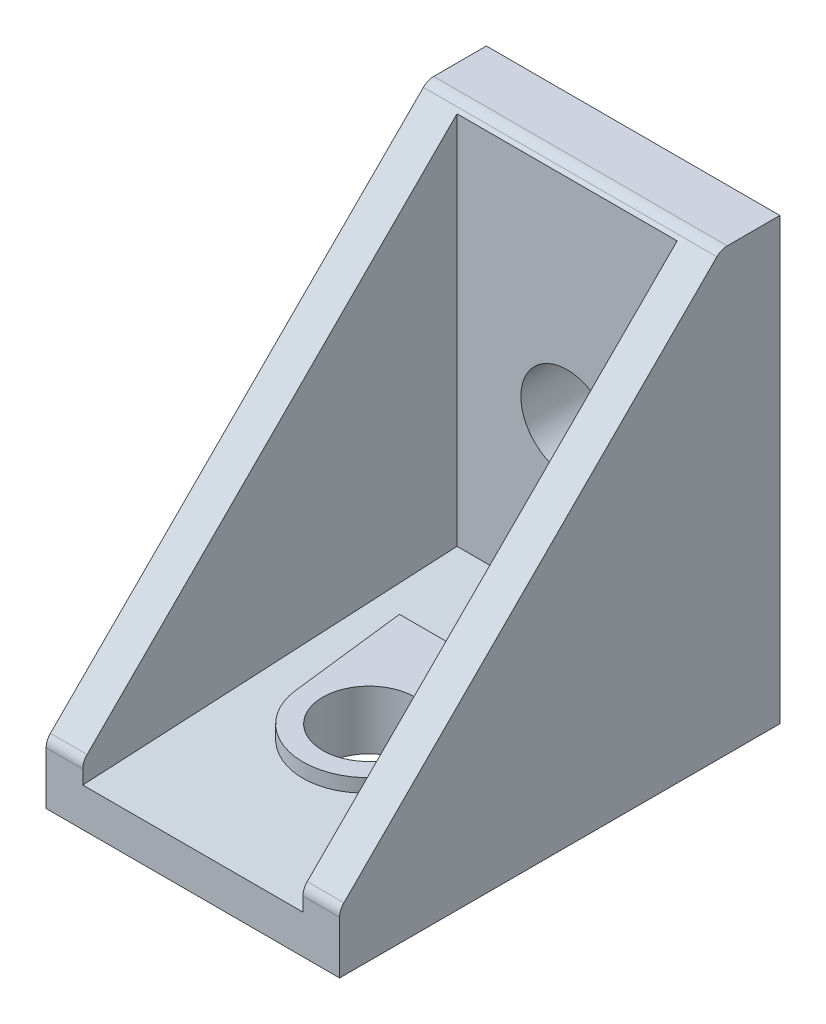
from build123d import *
from build123d.topology import SkipClean

# Parameters (mm, degrees)
BOSS_EXTRUDE1_DEPTH      = 10
BOSS_EXTRUDE1_DEPTH_BACK = 10
CUT_EXTRUDE1_DEPTH       = 7.5
CUT_EXTRUDE1_DEPTH_BACK  = 7.5
BOSS_EXTRUDE2_DEPTH      = 2
SKETCH4_R                = 3.15
CUT_EXTRUDE2_DEPTH       = 5
SKETCH5_R                = 3.15
CUT_EXTRUDE3_DEPTH       = 4
SKETCH6_W                = 20
SKETCH6_H                = 30
BOSS_EXTRUDE3_DEPTH      = 1
SKETCH7_W                = 20
SKETCH7_H                = 30
CUT_EXTRUDE4_DEPTH       = 1
SKETCH8_W                = 20
SKETCH8_H                = 30
BOSS_EXTRUDE4_DEPTH      = 1
CUT_EXTRUDE5_START       = -1
SKETCH9_W                = 20
SKETCH9_H                = 30
CUT_EXTRUDE5_DEPTH       = 1


with BuildPart() as part:
    # Sketch1 → Boss-Extrude1 (new, two sides: drawn at the far end of the back side and taken through both)
    with BuildSketch(Plane(origin=(0, 0, 0), x_dir=(0, 0, -1), z_dir=(1, 0, 0)).offset(-BOSS_EXTRUDE1_DEPTH_BACK)):
        with BuildLine():
            Line((-30, 0), (0, 0))
            Line((0, 0), (0, 30))
            Line((0, 30), (-3.585786438, 30))
            ThreePointArc((-3.585786438, 30), (-3.96846987, 29.923879533), (-4.292893219, 29.707106781))
            Line((-4.292893219, 29.707106781), (-29.707106781, 4.292893219))
            ThreePointArc((-29.707106781, 4.292893219), (-29.923879533, 3.96846987), (-30, 3.585786438))
            Line((-30, 3.585786438), (-30, 0))
        make_face()
    extrude(amount=BOSS_EXTRUDE1_DEPTH + BOSS_EXTRUDE1_DEPTH_BACK)

    # Sketch2 → Cut-Extrude1 (cut, two sides: drawn at the far end of the back side and taken through both)
    with BuildSketch(Plane(origin=(0, 0, 0), x_dir=(0, 0, -1), z_dir=(1, 0, 0)).offset(-CUT_EXTRUDE1_DEPTH_BACK)):
        Polygon((-34, 2.427766622), (-4.5, 3.97379611), (-4.5, 34), (-34, 34), align=None)
    extrude(amount=CUT_EXTRUDE1_DEPTH + CUT_EXTRUDE1_DEPTH_BACK, mode=Mode.SUBTRACT)

    # Sketch3 → Boss-Extrude2 (add)
    with BuildSketch(Plane(origin=(0, 4, 0), x_dir=(1, 0, 0), z_dir=(0, 1, 0))):
        with BuildLine():
            Line((-5.420884207, -10.5), (-4.4686916, -18.529901296))
            ThreePointArc((-4.4686916, -18.529901296), (0, -22.5), (4.4686916, -18.529901296))
            Line((4.4686916, -18.529901296), (5.420884207, -10.5))
            Line((5.420884207, -10.5), (-5.420884207, -10.5))
        make_face()
    extrude(amount=-BOSS_EXTRUDE2_DEPTH)

    # Sketch4 → Cut-Extrude2 (cut)
    with BuildSketch(Plane.XY):
        with Locations((0, 15)):
            Circle(SKETCH4_R)
    extrude(amount=CUT_EXTRUDE2_DEPTH, mode=Mode.SUBTRACT)

    # Sketch5 → Cut-Extrude3 (cut)
    with BuildSketch(Plane(origin=(0, 0, 0), x_dir=(1, 0, 0), z_dir=(0, 1, 0))):
        with Locations(Location((0, -18, 0), (0, 0, 270))):
            Circle(SKETCH5_R)
    extrude(amount=CUT_EXTRUDE3_DEPTH, mode=Mode.SUBTRACT)

    # Sketch6 → Boss-Extrude3 (add)
    with BuildSketch(Plane(origin=(0, 0, 0), x_dir=(1, 0, 0), z_dir=(0, 1, 0))):
        with Locations((0, -15)):
            Rectangle(SKETCH6_W, SKETCH6_H)
    extrude(amount=-BOSS_EXTRUDE3_DEPTH)

    # Sketch7 → Cut-Extrude4 (cut)
    with BuildSketch(Plane(origin=(0, 0, 0), x_dir=(1, 0, 0), z_dir=(0, 1, 0))):
        with Locations((0, -15)):
            Rectangle(SKETCH7_W, SKETCH7_H)
        with BuildLine():
            Line((-3.7, -13), (3.7, -13))
            ThreePointArc((3.7, -13), (3.912132034, -12.912132034), (4, -12.7))
            Line((4, -12.7), (4, -5.3))
            ThreePointArc((4, -5.3), (3.912132034, -5.087867966), (3.7, -5))
            Line((3.7, -5), (-3.7, -5))
            ThreePointArc((-3.7, -5), (-3.912132034, -5.087867966), (-4, -5.3))
            Line((-4, -5.3), (-4, -12.7))
            ThreePointArc((-4, -12.7), (-3.912132034, -12.912132034), (-3.7, -13))
        make_face(mode=Mode.SUBTRACT)
        with BuildLine():
            Line((-3.7, -27), (3.7, -27))
            ThreePointArc((3.7, -27), (3.912132034, -26.912132034), (4, -26.7))
            Line((4, -26.7), (4, -24.3))
            ThreePointArc((4, -24.3), (3.912132034, -24.087867966), (3.7, -24))
            Line((3.7, -24), (-3.7, -24))
            ThreePointArc((-3.7, -24), (-3.912132034, -24.087867966), (-4, -24.3))
            Line((-4, -24.3), (-4, -26.7))
            ThreePointArc((-4, -26.7), (-3.912132034, -26.912132034), (-3.7, -27))
        make_face(mode=Mode.SUBTRACT)
    extrude(amount=-CUT_EXTRUDE4_DEPTH, mode=Mode.SUBTRACT)

    # Sketch8 → Boss-Extrude4 (add)
    with BuildSketch(Plane.XY):
        with Locations((0, 15)):
            Rectangle(SKETCH8_W, SKETCH8_H)
    extrude(amount=-BOSS_EXTRUDE4_DEPTH)

    # Sketch9 → Cut-Extrude5 (cut)
    with SkipClean():  # the faces are left unmerged after this step: merging them gives an invalid solid
        with BuildSketch(Plane.XY.offset(CUT_EXTRUDE5_START)):
            with Locations((0, 15)):
                Rectangle(SKETCH9_W, SKETCH9_H)
            with BuildLine():
                Line((0.5, 11), (3, 11))
                ThreePointArc((3, 11), (3.707106781, 11.292893219), (4, 12))
                Line((4, 12), (4, 14.5))
                Line((4, 14.5), (3.110064308, 14.5))
                ThreePointArc((3.110064308, 14.5), (2.227386361, 12.772613639), (0.5, 11.889935692))
                Line((0.5, 11.889935692), (0.5, 11))
            make_face(mode=Mode.SUBTRACT)
            with BuildLine():
                Line((0.5, 19), (0.5, 18.110064308))
                ThreePointArc((0.5, 18.110064308), (2.227386361, 17.227386361), (3.110064308, 15.5))
                Line((3.110064308, 15.5), (4, 15.5))
                Line((4, 15.5), (4, 18))
                ThreePointArc((4, 18), (3.707106781, 18.707106781), (3, 19))
                Line((3, 19), (0.5, 19))
            make_face(mode=Mode.SUBTRACT)
            with BuildLine():
                Line((-3, 11), (-0.5, 11))
                Line((-0.5, 11), (-0.5, 11.889935692))
                ThreePointArc((-0.5, 11.889935692), (-2.227386361, 12.772613639), (-3.110064308, 14.5))
                Line((-3.110064308, 14.5), (-4, 14.5))
                Line((-4, 14.5), (-4, 12))
                ThreePointArc((-4, 12), (-3.707106781, 11.292893219), (-3, 11))
            make_face(mode=Mode.SUBTRACT)
            with BuildLine():
                Line((-4, 15.5), (-3.110064308, 15.5))
                ThreePointArc((-3.110064308, 15.5), (-2.227386361, 17.227386361), (-0.5, 18.110064308))
                Line((-0.5, 18.110064308), (-0.5, 19))
                Line((-0.5, 19), (-3, 19))
                ThreePointArc((-3, 19), (-3.707106781, 18.707106781), (-4, 18))
                Line((-4, 18), (-4, 15.5))
            make_face(mode=Mode.SUBTRACT)
        extrude(amount=CUT_EXTRUDE5_DEPTH, mode=Mode.SUBTRACT)


solid = part.part
